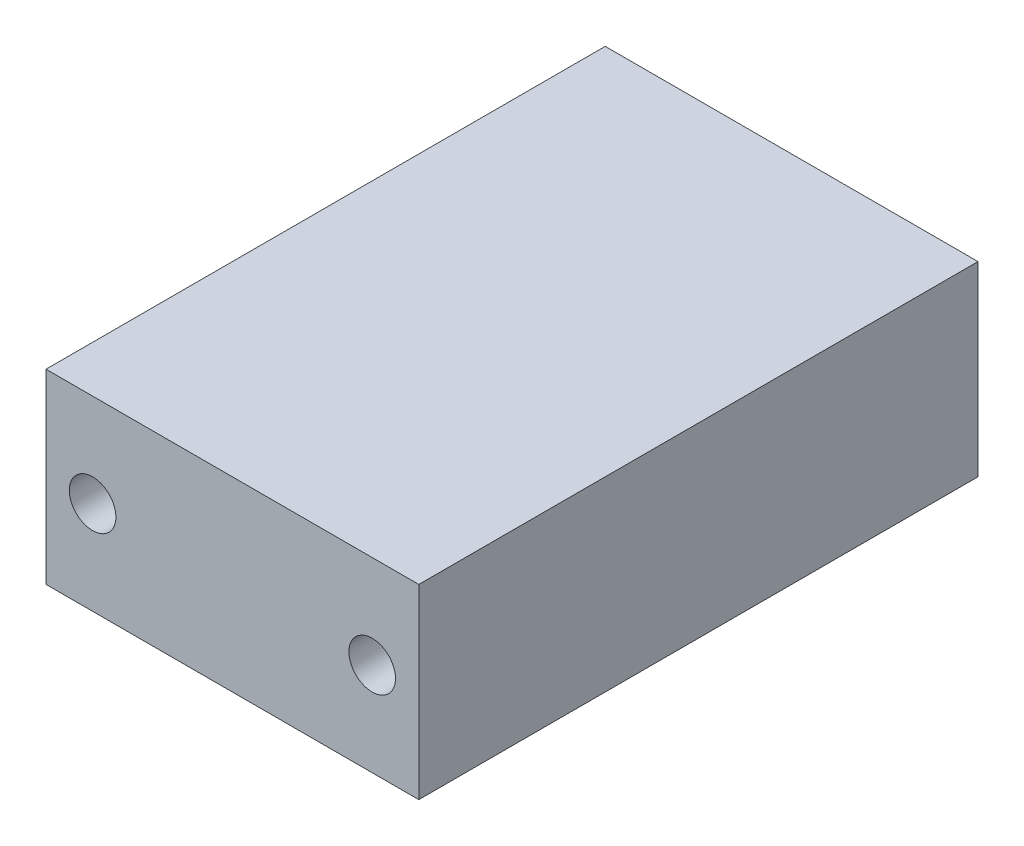
from build123d import *

# Parameters (mm, degrees)
SKETCH_1_W          = 80
SKETCH_1_H          = 40
EXTRUDE_1_DEPTH     = 120
SKETCH_2_R          = 5
CUT_EXTRUDE_1_DEPTH = 120


with BuildPart() as part:
    # 草图1 → 凸台-拉伸1 (new body)
    with BuildSketch(Plane.XY):
        Rectangle(SKETCH_1_W, SKETCH_1_H)
    extrude(amount=EXTRUDE_1_DEPTH)

    # 草图2 → 切除-拉伸1 (cut)
    with BuildSketch(Plane.XY.offset(120)):
        with Locations((-30, 0)):
            Circle(SKETCH_2_R)
        with Locations((30, 0)):
            Circle(SKETCH_2_R)
    extrude(amount=-CUT_EXTRUDE_1_DEPTH, mode=Mode.SUBTRACT)


solid = part.part
